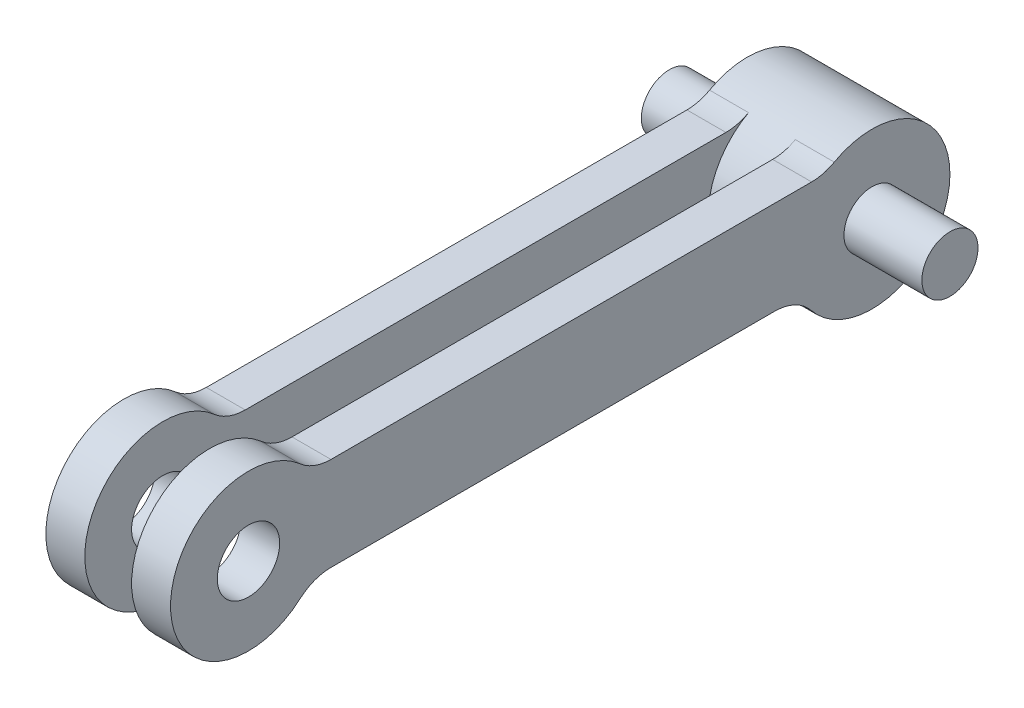
from build123d import *

# Parameters (mm, degrees)
SKETCH_1_R                  = 5
SKETCH_1_W                  = 40
SKETCH_1_H                  = 6
EXTRUDE_1_DEPTH             = 2.5
CUT_EXTRUDE_2_DEPTH         = 46.467021015
CUT_EXTRUDE_2_DEPTH_BACK    = 46.467021015
SKETCH_1_3_R                = 2
FILLET_1_R                  = 3
EXTRUDE_START               = -1.5
SKETCH_1_4_R                = 5
SKETCH_1_4_R_2              = 2
EXTRUDE_2_DEPTH             = 1.5
SKETCH_2_R                  = 1.8
EXTRUDE_4_DEPTH             = 5
EXTRUDE_5_REACH             = 48.014
SKETCH_1_5_R                = 2
EXTRUDE_5_DIRECTION_2_REACH = 48.014


with BuildPart() as part:
    # 草图1 → 凸台-拉伸1 (new body)
    with BuildSketch(Plane(origin=(0, 0, 0), x_dir=(0, 0, -1), z_dir=(1, 0, 0))):
        Circle(SKETCH_1_R)
        with Locations((40, -1)):
            Circle(SKETCH_1_R)
        with Locations((20, 0)):
            Rectangle(SKETCH_1_W, SKETCH_1_H)
    extrude(amount=EXTRUDE_1_DEPTH)

    # 草图1<3> → 切除-拉伸2 (cut, two sides: drawn at the far end of the back side and taken through both)
    with BuildSketch(Plane(origin=(0, 0, 0), x_dir=(0, 0, -1), z_dir=(1, 0, 0)).offset(-CUT_EXTRUDE_2_DEPTH_BACK)):
        Circle(SKETCH_1_3_R)
        with Locations((40, -1)):
            Circle(SKETCH_1_3_R)
    extrude(amount=CUT_EXTRUDE_2_DEPTH + CUT_EXTRUDE_2_DEPTH_BACK, mode=Mode.SUBTRACT)

    # 圆角1
    fillet_1_edges = [part.edges().sort_by_distance(p)[0] for p in [
        (1.25, -3, -4),
        (1.25, -3, -35.417424305),
        (1.25, 3, -37),
        (1.25, 3, -4),
    ]]
    fillet(fillet_1_edges, radius=FILLET_1_R)

    # 草图1<4> → 凸台-拉伸2 (add)
    with BuildSketch(Plane(origin=(0, 0, 0), x_dir=(0, 0, -1), z_dir=(1, 0, 0)).offset(EXTRUDE_START)):
        with Locations((40, -1)):
            Circle(SKETCH_1_4_R)
        with Locations((40, -1)):
            Circle(SKETCH_1_4_R_2, mode=Mode.SUBTRACT)
    extrude(amount=EXTRUDE_2_DEPTH)

    # 凸台-拉伸5: up to this face of the body (flat: up to its plane)
    extrude_5_end = Plane(part.part.faces().sort_by_distance((2.5, -0.197791912, -20.041492076))[0])
    # 草图1<5> → 凸台-拉伸5 (add, up to the picked face)
    with BuildSketch(Plane(origin=(0, 0, 0), x_dir=(0, 0, -1), z_dir=(1, 0, 0)), mode=Mode.PRIVATE) as extrude_5_sk1:
        with Locations((40, -1)):
            Circle(SKETCH_1_5_R)
    extrude_5_tool1 = split(extrude(extrude_5_sk1.sketch, amount=EXTRUDE_5_REACH, mode=Mode.PRIVATE), bisect_by=extrude_5_end, keep=Keep.BOTH, mode=Mode.PRIVATE)


with BuildPart() as body_2:
    # 草图2 → 凸台-拉伸4 (new body)
    with BuildSketch(Plane(origin=(2.5, 0, 0), x_dir=(0, 0, -1), z_dir=(1, 0, 0))):
        with Locations((40, -1)):
            Circle(SKETCH_2_R)
    extrude(amount=EXTRUDE_4_DEPTH)


with BuildPart() as part_1:
    add(part.part)

    add(body_2.part)  # 凸台-拉伸5 merges body 2
    add(extrude_5_tool1.solids().sort_by(Axis((0, -1, -40), (1, 0, 0)))[0])

    # 凸台-拉伸5 direction 2: up to this face of the body (flat: up to its plane)
    extrude_5_direction_2_end = Plane(part_1.part.faces().sort_by_distance((-1.5, -1, -35.141421356))[0])
    # 草图1<5> → 凸台-拉伸5 direction 2 (add, up to the picked face)
    with BuildSketch(Plane(origin=(0, 0, 0), x_dir=(0, 0, -1), z_dir=(1, 0, 0)), mode=Mode.PRIVATE) as extrude_5_direction_2_sk1:
        with Locations((40, -1)):
            Circle(SKETCH_1_5_R)
    extrude_5_direction_2_tool1 = split(extrude(extrude_5_direction_2_sk1.sketch, amount=-EXTRUDE_5_DIRECTION_2_REACH, mode=Mode.PRIVATE), bisect_by=extrude_5_direction_2_end, keep=Keep.BOTH, mode=Mode.PRIVATE)
    add(extrude_5_direction_2_tool1.solids().sort_by(Axis((0, -1, -40), (-1, 0, 0)))[0])

    # 镜向3: part across plane


with BuildPart() as part_2:
    add(part_1.part)
    add(part_1.part.mirror(Plane.ZY.offset(1.5)))


solid = part_2.part
